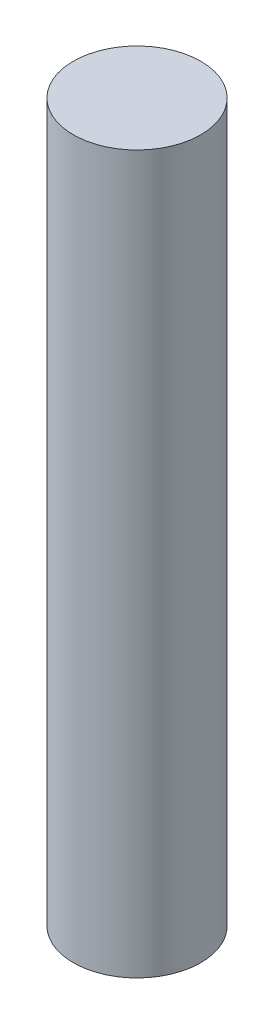
from build123d import *

# Parameters (mm, degrees)
OVEN_KESME_AKTUATOR_MILI_START = 470
SKETCH1_R                      = 8
OVEN_KESME_AKTUATOR_MILI_DEPTH = 90


with BuildPart() as part:
    # Sketch1 → OVEN_kesme_aktuator_mili (new body)
    with BuildSketch(Plane(origin=(0, 0, 0), x_dir=(1, 0, 0), z_dir=(0, 1, 0)).offset(OVEN_KESME_AKTUATOR_MILI_START)):
        with Locations(Location((350, 300, 0), (0, 0, 90))):
            Circle(SKETCH1_R)
    extrude(amount=OVEN_KESME_AKTUATOR_MILI_DEPTH)


solid = part.part
